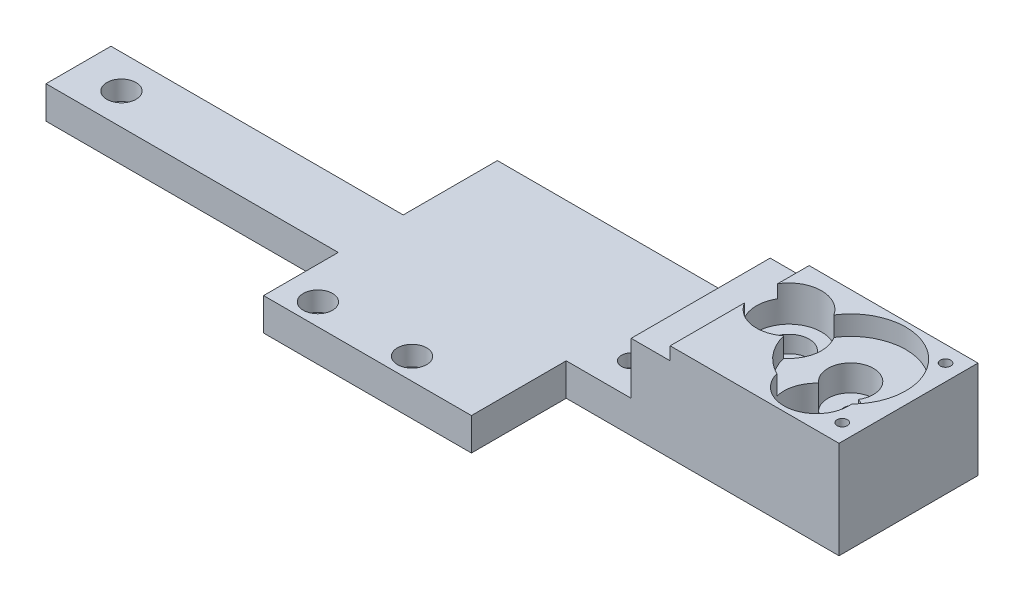
from build123d import *

# Parameters (mm, degrees)
SKETCH_1_W           = 42
SKETCH_1_H           = 21.4
EXTRUDE_1_DEPTH      = 12
SKETCH_2_W           = 6
SKETCH_2_H           = 2
CUT_EXTRUDE_1_DEPTH  = 49.641134855
SKETCH_3_R           = 5
CUT_EXTRUDE_2_DEPTH  = 5.5
SKETCH_3_3_R         = 8.5
CUT_EXTRUDE_3_DEPTH  = 3
SKETCH_3_4_R         = 3.5
CUT_EXTRUDE_4_DEPTH  = 7
SKETCH_3_5_R         = 5
CUT_EXTRUDE_5_DEPTH  = 8.5
CUT_EXTRUDE_START    = -8.5
SKETCH_3_6_R         = 3.1
CUT_EXTRUDE_6_DEPTH  = 2.6
CUT_EXTRUDE_START_2  = -5.5
SKETCH_3_7_R         = 3.1
CUT_EXTRUDE_7_DEPTH  = 2.6
EXTRUDE_START        = -2
SKETCH_4_W           = 42
SKETCH_4_H           = 21.4
SKETCH_4_W_2         = 45
SKETCH_4_H_2         = 10
EXTRUDE_2_DEPTH      = 5
SKETCH_5_R           = 2.25
CUT_EXTRUDE_8_DEPTH  = 3
SKETCH_5_3_R         = 1.5
CUT_EXTRUDE_9_DEPTH  = 86.586213843
SKETCH_3_8_R         = 1.05
SKETCH_3_8_R_2       = 2
CUT_EXTRUDE_10_DEPTH = 87.313382508
SKETCH_6_R           = 1.5
CUT_EXTRUDE_11_DEPTH = 87.313382508
SKETCH_6_3_R         = 2.25
CUT_EXTRUDE_12_DEPTH = 3
SKETCH_7_R           = 0.8
CUT_EXTRUDE_13_DEPTH = 4
SKETCH_3_9_R         = 3.1
CUT_EXTRUDE_14_DEPTH = 2.6
SKETCH_8_W           = 175.744620812
SKETCH_8_H           = 75.979306291
CUT_EXTRUDE_15_DEPTH = 89.600225733
SKETCH_9_W           = 32
SKETCH_9_H           = 11.5
EXTRUDE_3_DEPTH      = 5
SKETCH_10_R          = 1.5
CUT_EXTRUDE_16_DEPTH = 86.586213843
SKETCH_10_4_R        = 2.25
CUT_EXTRUDE_17_DEPTH = 3


with BuildPart() as part:
    # 草图1 → 凸台-拉伸1 (new body)
    with BuildSketch(Plane(origin=(0, 0, 0), x_dir=(1, 0, 0), z_dir=(0, 1, 0))):
        with Locations((21, -10.7)):
            Rectangle(SKETCH_1_W, SKETCH_1_H)
    extrude(amount=EXTRUDE_1_DEPTH)

    # 草图2 → 切除-拉伸1 (cut, through all)
    with BuildSketch(Plane(origin=(0, 0, 0), x_dir=(-1, 0, 0), z_dir=(0, 0, -1))):
        Polygon((-10, 0), (0, 0), (0, 10), (-10, 10), (-10, 2), align=None)
        with Locations((-13, 1)):
            Rectangle(SKETCH_2_W, SKETCH_2_H)
    extrude(amount=-CUT_EXTRUDE_1_DEPTH, mode=Mode.SUBTRACT)

    # 草图3 → 切除-拉伸2 (cut)
    with BuildSketch(Plane.XZ):
        with Locations(Location((20.3, 7.4, 0), (0, 0, 270))):
            Circle(SKETCH_3_R)
    extrude(amount=-CUT_EXTRUDE_2_DEPTH, mode=Mode.SUBTRACT)

    # 草图3<3> → 切除-拉伸3 (cut)
    with BuildSketch(Plane.XZ):
        with Locations((31.64970263, 9.253173011)):
            Circle(SKETCH_3_3_R)
    extrude(amount=-CUT_EXTRUDE_3_DEPTH, mode=Mode.SUBTRACT)

    # 草图3<4> → 切除-拉伸4 (cut)
    with BuildSketch(Plane.XZ):
        with Locations(Location((31.64970263, 9.253173011, 0), (0, 0, 270))):
            Circle(SKETCH_3_4_R)
    extrude(amount=-CUT_EXTRUDE_4_DEPTH, mode=Mode.SUBTRACT)

    # 草图3<5> → 切除-拉伸5 (cut)
    with BuildSketch(Plane.XZ):
        with Locations(Location((32.76916715, 15.656047301, 0), (0, 0, 270))):
            Circle(SKETCH_3_5_R)
    extrude(amount=-CUT_EXTRUDE_5_DEPTH, mode=Mode.SUBTRACT)

    # 草图3<6> → 切除-拉伸6 (cut)
    with BuildSketch(Plane.XZ.offset(CUT_EXTRUDE_START)):
        with Locations(Location((32.76916715, 15.656047301, 0), (0, 0, 270))):
            Circle(SKETCH_3_6_R)
    extrude(amount=-CUT_EXTRUDE_6_DEPTH, mode=Mode.SUBTRACT)

    # 草图3<7> → 切除-拉伸7 (cut)
    with BuildSketch(Plane.XZ.offset(CUT_EXTRUDE_START_2)):
        with Locations(Location((20.3, 7.4, 0), (0, 0, 270))):
            Circle(SKETCH_3_7_R)
    extrude(amount=-CUT_EXTRUDE_7_DEPTH, mode=Mode.SUBTRACT)

    # 草图4 → 凸台-拉伸2 (add)
    with BuildSketch(Plane(origin=(0, 12, 0), x_dir=(1, 0, 0), z_dir=(0, 1, 0)).offset(EXTRUDE_START)):
        with Locations((21, -10.7)):
            Rectangle(SKETCH_4_W, SKETCH_4_H)
        Polygon((0, -21.4), (0, 0), (-32, 0), (-32, -14.5), (-32, -24.5), (-32, -36), (0, -36), align=None)
        with Locations((-54.5, -19.5)):
            Rectangle(SKETCH_4_W_2, SKETCH_4_H_2)
    extrude(amount=EXTRUDE_2_DEPTH)

    # 草图5 → 切除-拉伸8 (cut)
    with BuildSketch(Plane.XZ.offset(-10)):
        with Locations((-7.480832871, 32.656047307)):
            Circle(SKETCH_5_R)
        with Locations((-21.980832871, 32.656047307)):
            Circle(SKETCH_5_R)
        with Locations((-70.230832871, 19.656047307)):
            Circle(SKETCH_5_R)
    extrude(amount=-CUT_EXTRUDE_8_DEPTH, mode=Mode.SUBTRACT)

    # 草图5<3> → 切除-拉伸9 (cut, through all)
    with BuildSketch(Plane.XZ.offset(-10)):
        with Locations((-70.230832871, 19.656047307)):
            Circle(SKETCH_5_3_R)
        with Locations((-21.980832871, 32.656047307)):
            Circle(SKETCH_5_3_R)
        with Locations((-7.480832871, 32.656047307)):
            Circle(SKETCH_5_3_R)
    extrude(amount=-CUT_EXTRUDE_9_DEPTH, mode=Mode.SUBTRACT)

    # 草图3<8> → 切除-拉伸10 (cut, through all)
    with BuildSketch(Plane.XZ):
        with Locations(Location((31.64970263, 9.253173011, 0), (0, 0, 270))):
            Circle(SKETCH_3_8_R)
        with Locations(Location((32.76916715, 15.656047301, 0), (0, 0, 270))):
            Circle(SKETCH_3_8_R_2)
    extrude(amount=-CUT_EXTRUDE_10_DEPTH, mode=Mode.SUBTRACT)

    # 草图6 → 切除-拉伸11 (cut, through all)
    with BuildSketch(Plane(origin=(0, 15, 0), x_dir=(1, 0, 0), z_dir=(0, 1, 0))):
        with Locations(Location((5, -5, 0), (0, 0, 180))):
            Circle(SKETCH_6_R)
        with Locations(Location((5, -16.4, 0), (0, 0, 180))):
            Circle(SKETCH_6_R)
    extrude(amount=-CUT_EXTRUDE_11_DEPTH, mode=Mode.SUBTRACT)

    # 草图6<3> → 切除-拉伸12 (cut)
    with BuildSketch(Plane(origin=(0, 15, 0), x_dir=(1, 0, 0), z_dir=(0, 1, 0))):
        with Locations(Location((5, -5, 0), (0, 0, 180))):
            Circle(SKETCH_6_3_R)
        with Locations(Location((5, -16.4, 0), (0, 0, 180))):
            Circle(SKETCH_6_3_R)
    extrude(amount=-CUT_EXTRUDE_12_DEPTH, mode=Mode.SUBTRACT)

    # 草图7 → 切除-拉伸13 (cut)
    with BuildSketch(Plane.XZ):
        with Locations(Location((39.5, 18.4, 0), (0, 0, 270))):
            Circle(SKETCH_7_R)
        with Locations(Location((39.5, 2.5, 0), (0, 0, 270))):
            Circle(SKETCH_7_R)
    extrude(amount=-CUT_EXTRUDE_13_DEPTH, mode=Mode.SUBTRACT)

    # 草图3<9> → 切除-拉伸14 (cut)
    with BuildSketch(Plane.XZ.offset(CUT_EXTRUDE_START)):
        with Locations(Location((32.76916715, 15.656047301, 0), (0, 0, 270))):
            Circle(SKETCH_3_9_R)
    extrude(amount=-CUT_EXTRUDE_14_DEPTH, mode=Mode.SUBTRACT)


with BuildPart() as body_2:
    # 镜向2: mirrored copy
    add(part.part.mirror(Plane.ZX.offset(-10)))

    # 草图9 → 凸台-拉伸3 (add, through all)
    with BuildSketch(Plane(origin=(0, -30, 0), x_dir=(1, 0, 0), z_dir=(0, 1, 0))):
        with Locations((-16, -30.25)):
            Rectangle(SKETCH_9_W, SKETCH_9_H)
    extrude(amount=-EXTRUDE_3_DEPTH)

    # 草图10 → 切除-拉伸16 (cut, through all)
    with BuildSketch(Plane(origin=(0, -30, 0), x_dir=(1, 0, 0), z_dir=(0, 1, 0))):
        with Locations(Location((-26.980832871, -32.656047307, 0), (0, 0, 180))):
            Circle(SKETCH_10_R)
        with Locations(Location((-12.480832871, -32.656047307, 0), (0, 0, 180))):
            Circle(SKETCH_10_R)
    extrude(amount=-CUT_EXTRUDE_16_DEPTH, mode=Mode.SUBTRACT)

    # 草图10<4> → 切除-拉伸17 (cut)
    with BuildSketch(Plane(origin=(0, -30, 0), x_dir=(1, 0, 0), z_dir=(0, 1, 0))):
        with Locations(Location((-26.980832871, -32.656047307, 0), (0, 0, 180))):
            Circle(SKETCH_10_4_R)
        with Locations(Location((-12.480832871, -32.656047307, 0), (0, 0, 180))):
            Circle(SKETCH_10_4_R)
    extrude(amount=-CUT_EXTRUDE_17_DEPTH, mode=Mode.SUBTRACT)


with BuildPart() as part_1:
    add(part.part)

    # 草图8 → 切除-拉伸15 (cut, through all)
    with BuildSketch(Plane(origin=(0, -10, 0), x_dir=(1, 0, 0), z_dir=(0, 1, 0))):
        with Locations((-15.393239271, -18.067960024)):
            Rectangle(SKETCH_8_W, SKETCH_8_H)
    extrude(amount=CUT_EXTRUDE_15_DEPTH, mode=Mode.SUBTRACT)


solid = body_2.part
